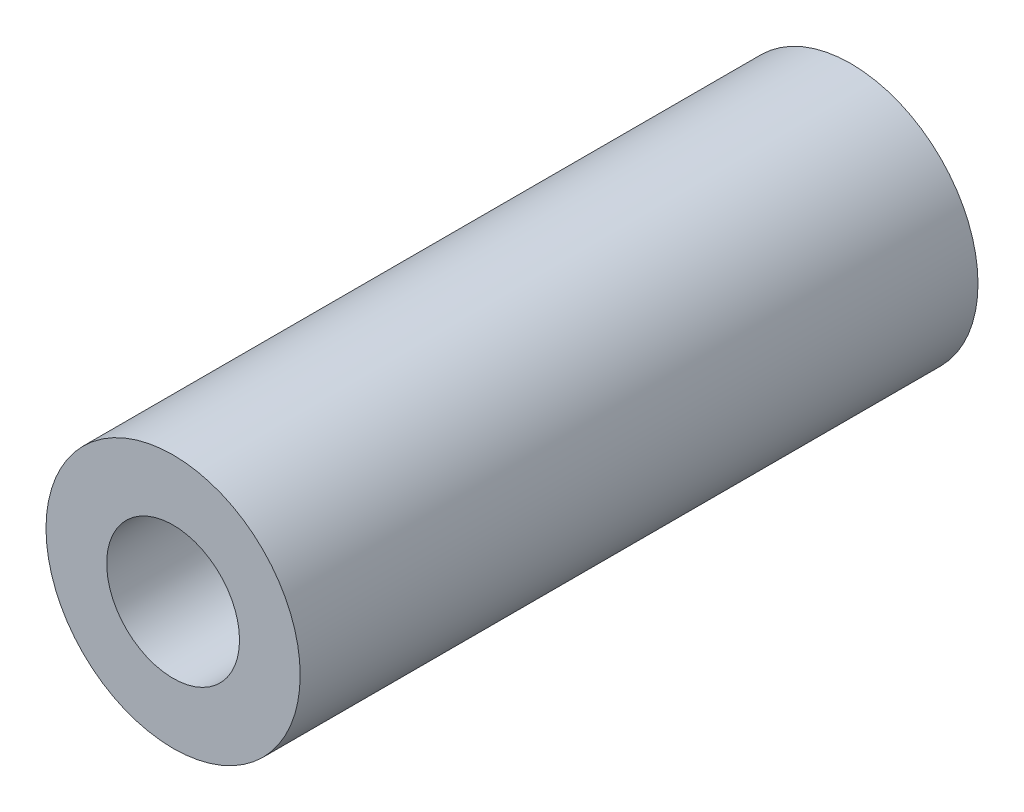
from build123d import *

# Parameters (mm, degrees)
SKETCH1_R           = 4.7625
SKETCH1_R_2         = 2.4892
BOSS_EXTRUDE1_DEPTH = 12.7


with BuildPart() as part:
    # Sketch1 → Boss-Extrude1 (new, symmetric)
    with BuildSketch(Plane.XY):
        Circle(SKETCH1_R)
        Circle(SKETCH1_R_2, mode=Mode.SUBTRACT)
    extrude(amount=BOSS_EXTRUDE1_DEPTH, both=True)


solid = part.part
